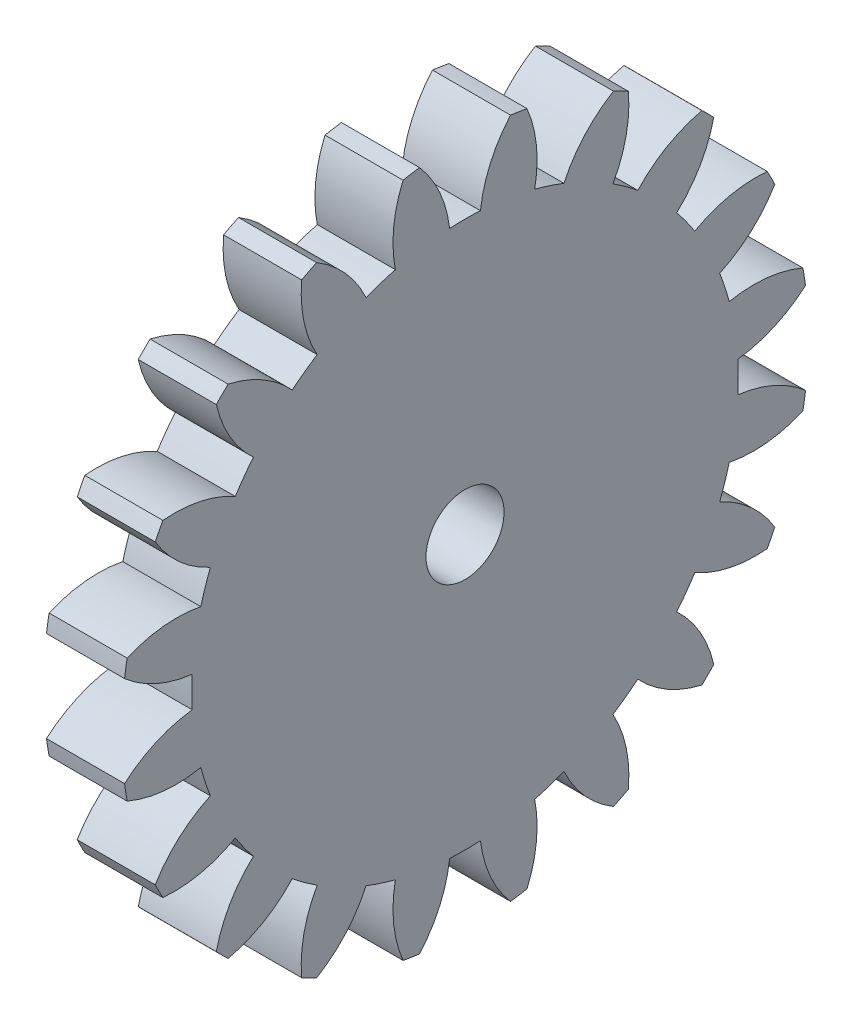
from build123d import *

# Parameters (mm, degrees)
BASPROSKE_W      = 5
BASPROSKE_H      = 22
TOOTHCUT_DEPTH   = 32.511902513
TEETHCUTS_COUNT  = 20
TEETHCUTS_ANGLE  = 342
HUBNEAONESKE_R   = 3
HUBNEARONE_DEPTH = 5.0000508
BORSKE_R         = 2.5
BORE_DEPTH       = 10.0000508


with BuildPart() as part:
    # BasProSke → Base-Revolve (revolve)
    with BuildSketch(Plane(origin=(0, 0, 0), x_dir=(1, 0, 0), z_dir=(0, 1, 0)), mode=Mode.PRIVATE) as base_revolve_sk:
        with Locations((2.5, 11)):
            Rectangle(BASPROSKE_W, BASPROSKE_H)
    revolve(base_revolve_sk.sketch.rotate(Axis((-10, 0, 0), (1, 0, 0)), 180), axis=Axis((-10, 0, 0), (1, 0, 0)))

    # TooCutSke → ToothCut (cut, through all)
    with BuildSketch(Plane(origin=(0, 0, 0), x_dir=(0, 0, -1), z_dir=(1, 0, 0))):
        with BuildLine():
            ThreePointArc((0.986171591, 17.471189616), (0, 17.499), (-0.986171591, 17.471189616))
            ThreePointArc((-0.986171591, 17.471189616), (-1.626916196, 19.798789858), (-2.932850173, 21.829260982))
            ThreePointArc((-2.932850173, 21.829260982), (0, 22.0254), (2.932850173, 21.829260982))
            ThreePointArc((2.932850173, 21.829260982), (1.626916196, 19.798789858), (0.986171591, 17.471189616))
        make_face()
    toothcut = extrude(amount=TOOTHCUT_DEPTH, mode=Mode.SUBTRACT)

    # TeethCuts: ToothCut ×20 about axis
    teethcuts_axis = Axis((-10, 0, 0), (1, 0, 0))
    for i in range(1, TEETHCUTS_COUNT):
        add(toothcut.rotate(teethcuts_axis, i * TEETHCUTS_ANGLE / (TEETHCUTS_COUNT - 1)), mode=Mode.SUBTRACT)

    # HubNeaOneSke → HubNearOne (add)
    with BuildSketch(Plane.ZY):
        with Locations(Location((0, 0, 0), (0, 0, 180))):
            Circle(HUBNEAONESKE_R)
    extrude(amount=HUBNEARONE_DEPTH)

    # BorSke → Bore (cut, symmetric)
    with BuildSketch(Plane(origin=(0, 0, 0), x_dir=(0, 0, -1), z_dir=(1, 0, 0))):
        with Locations(Location((0, 0, 0), (0, 0, 180))):
            Circle(BORSKE_R)
    extrude(amount=BORE_DEPTH, both=True, mode=Mode.SUBTRACT)


solid = part.part
